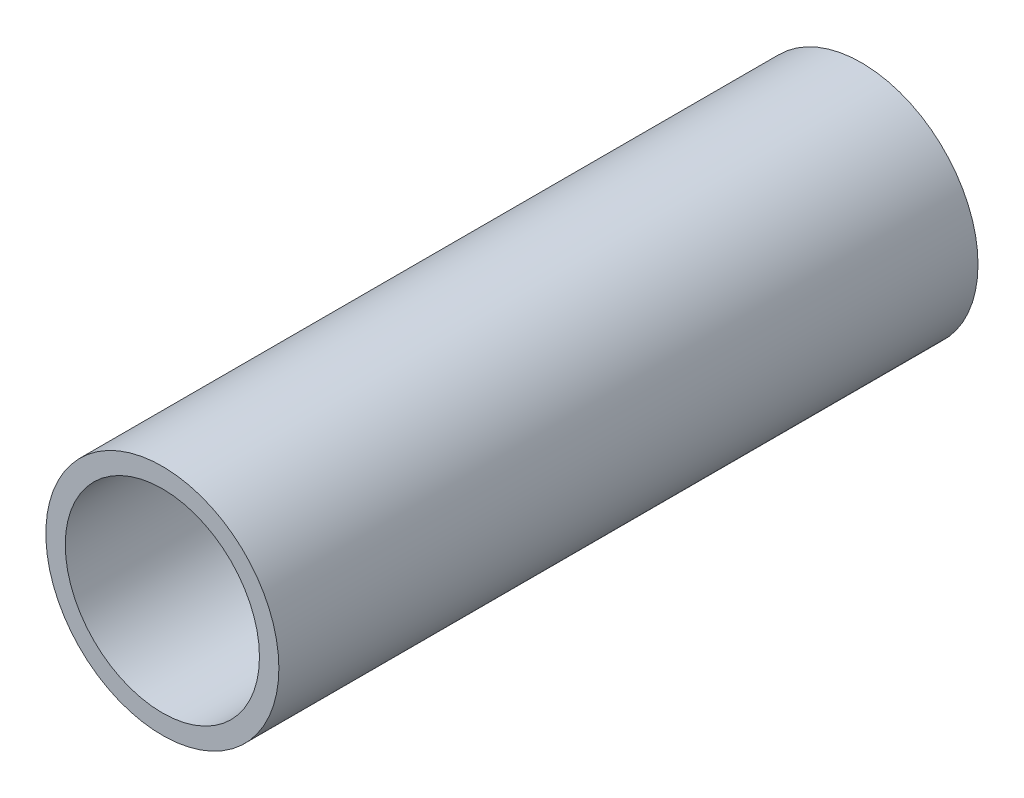
from build123d import *

# Parameters (mm, degrees)
SKETCH_1_R      = 3
SKETCH_1_R_2    = 2.5
EXTRUDE_1_DEPTH = 18


with BuildPart() as part:
    # 草图1 → 凸台-拉伸1 (new body)
    with BuildSketch(Plane.XY):
        Circle(SKETCH_1_R)
        Circle(SKETCH_1_R_2, mode=Mode.SUBTRACT)
    extrude(amount=EXTRUDE_1_DEPTH)


solid = part.part
